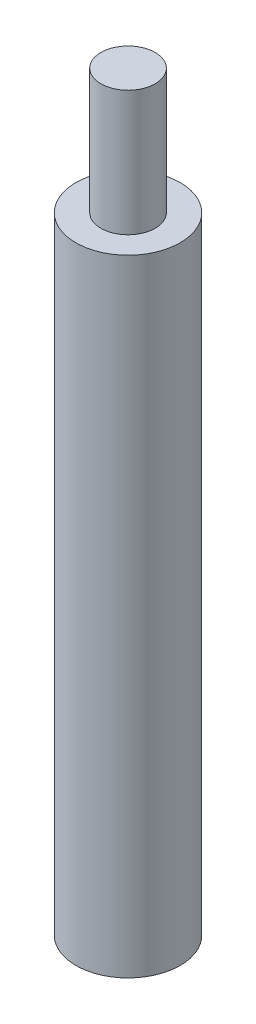
from build123d import *

# Parameters (mm, degrees)
SKETCH1_R           = 6.35
BOSS_EXTRUDE1_DEPTH = 76.2
SKETCH2_R           = 3.302
BOSS_EXTRUDE2_DEPTH = 15.24


with BuildPart() as part:
    # Sketch1 → Boss-Extrude1 (new body)
    with BuildSketch(Plane(origin=(0, 0, 0), x_dir=(1, 0, 0), z_dir=(0, 1, 0))):
        with Locations(Location((0, 0, 0), (0, 0, 90))):
            Circle(SKETCH1_R)
    extrude(amount=BOSS_EXTRUDE1_DEPTH)

    # Sketch2 → Boss-Extrude2 (add)
    with BuildSketch(Plane(origin=(0, 76.2, 0), x_dir=(1, 0, 0), z_dir=(0, 1, 0))):
        with Locations(Location((0, 0, 0), (0, 0, 90))):
            Circle(SKETCH2_R)
    extrude(amount=BOSS_EXTRUDE2_DEPTH)


solid = part.part
